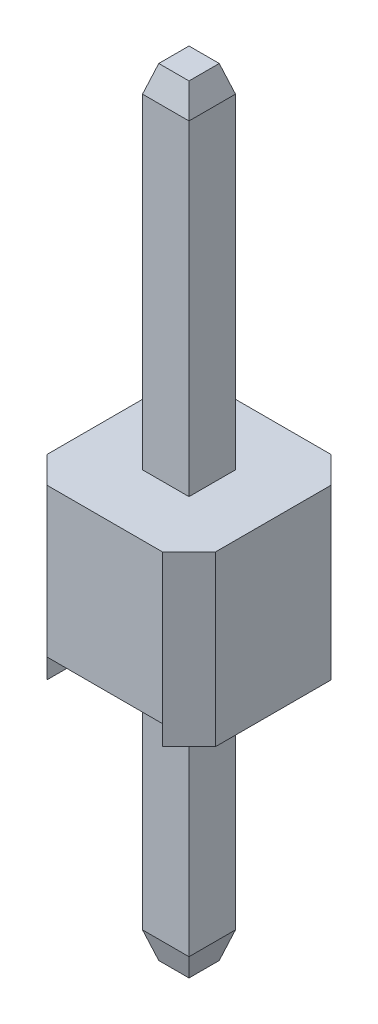
from build123d import *
from OCP.BRepFilletAPI import BRepFilletAPI_MakeChamfer

# Parameters (mm, degrees)
SKETCH1_W           = 2.54
SKETCH1_H           = 2.54
BOSS_EXTRUDE1_DEPTH = 2.54
CHAMFER1_SIZE       = 0.4
SKETCH2_W           = 1.74
SKETCH2_H           = 2.54
CUT_EXTRUDE1_DEPTH  = 0.3
SKETCH3_W           = 0.7
SKETCH3_H           = 0.7
BOSS_EXTRUDE2_DEPTH = 5.3
SKETCH4_W           = 0.7
SKETCH4_H           = 0.7
BOSS_EXTRUDE3_DEPTH = 4.16
CHAMFER2_SIZE       = 0.4
CHAMFER2_SIZE2      = 0.122292273


with BuildPart() as part:
    # Sketch1 → Boss-Extrude1 (new body)
    with BuildSketch(Plane(origin=(0, 0, 0), x_dir=(1, 0, 0), z_dir=(0, 1, 0))):
        Rectangle(SKETCH1_W, SKETCH1_H)
    extrude(amount=BOSS_EXTRUDE1_DEPTH)

    # Chamfer1
    chamfer1_edges = [part.edges().sort_by_distance(p)[0] for p in [
        (1.27, 1.27, 1.27),
        (-1.27, 1.27, 1.27),
        (-1.27, 1.27, -1.27),
        (1.27, 1.27, -1.27),
    ]]
    chamfer(chamfer1_edges, length=CHAMFER1_SIZE)

    # Sketch2 → Cut-Extrude1 (cut)
    with BuildSketch(Plane.XZ):
        Rectangle(SKETCH2_W, SKETCH2_H)
    extrude(amount=-CUT_EXTRUDE1_DEPTH, mode=Mode.SUBTRACT)

    # Sketch3 → Boss-Extrude2 (add)
    with BuildSketch(Plane(origin=(0, 2.54, 0), x_dir=(1, 0, 0), z_dir=(0, 1, 0))):
        Rectangle(SKETCH3_W, SKETCH3_H)
    extrude(amount=BOSS_EXTRUDE2_DEPTH)

    # Sketch4 → Boss-Extrude3 (add)
    with BuildSketch(Plane.XZ.offset(-0.3)):
        Rectangle(SKETCH4_W, SKETCH4_H)
    extrude(amount=BOSS_EXTRUDE3_DEPTH)

    # Chamfer2: one chamfer whose edges measure the first distance from different faces: ONE call of the kernel's chamfer builder (chamfer() names one face for all edges)
    chamfer2_edges_1 = [part.edges().sort_by_distance(p)[0] for p in [
        (-0.35, 7.84, 0),
    ]]
    chamfer2_side_1 = [part.faces().sort_by_distance(p)[0] for p in [
        (-0.35, 5.19, 0),
    ]]
    chamfer2_edges_2 = [part.edges().sort_by_distance(p)[0] for p in [
        (0, 7.84, 0.35),
    ]]
    chamfer2_side_2 = [part.faces().sort_by_distance(p)[0] for p in [
        (0, 5.19, 0.35),
    ]]
    chamfer2_edges_3 = [part.edges().sort_by_distance(p)[0] for p in [
        (0.35, 7.84, 0),
    ]]
    chamfer2_side_3 = [part.faces().sort_by_distance(p)[0] for p in [
        (0.35, 5.19, 0),
    ]]
    chamfer2_edges_4 = [part.edges().sort_by_distance(p)[0] for p in [
        (0, 7.84, -0.35),
    ]]
    chamfer2_side_4 = [part.faces().sort_by_distance(p)[0] for p in [
        (0, 5.19, -0.35),
    ]]
    chamfer2_edges_5 = [part.edges().sort_by_distance(p)[0] for p in [
        (0, -3.86, -0.35),
    ]]
    chamfer2_side_5 = [part.faces().sort_by_distance(p)[0] for p in [
        (0, -1.78, -0.35),
    ]]
    chamfer2_edges_6 = [part.edges().sort_by_distance(p)[0] for p in [
        (0.35, -3.86, 0),
    ]]
    chamfer2_side_6 = [part.faces().sort_by_distance(p)[0] for p in [
        (0.35, -1.78, 0),
    ]]
    chamfer2_edges_7 = [part.edges().sort_by_distance(p)[0] for p in [
        (0, -3.86, 0.35),
    ]]
    chamfer2_side_7 = [part.faces().sort_by_distance(p)[0] for p in [
        (0, -1.78, 0.35),
    ]]
    chamfer2_edges_8 = [part.edges().sort_by_distance(p)[0] for p in [
        (-0.35, -3.86, 0),
    ]]
    chamfer2_side_8 = [part.faces().sort_by_distance(p)[0] for p in [
        (-0.35, -1.78, 0),
    ]]
    chamfer2 = BRepFilletAPI_MakeChamfer(part.part.solid().wrapped)
    for e in chamfer2_edges_1:
        chamfer2.Add(CHAMFER2_SIZE, CHAMFER2_SIZE2, e.wrapped, chamfer2_side_1[0].wrapped)  # the first distance lies on this face
    for e in chamfer2_edges_2:
        chamfer2.Add(CHAMFER2_SIZE, CHAMFER2_SIZE2, e.wrapped, chamfer2_side_2[0].wrapped)  # the first distance lies on this face
    for e in chamfer2_edges_3:
        chamfer2.Add(CHAMFER2_SIZE, CHAMFER2_SIZE2, e.wrapped, chamfer2_side_3[0].wrapped)  # the first distance lies on this face
    for e in chamfer2_edges_4:
        chamfer2.Add(CHAMFER2_SIZE, CHAMFER2_SIZE2, e.wrapped, chamfer2_side_4[0].wrapped)  # the first distance lies on this face
    for e in chamfer2_edges_5:
        chamfer2.Add(CHAMFER2_SIZE, CHAMFER2_SIZE2, e.wrapped, chamfer2_side_5[0].wrapped)  # the first distance lies on this face
    for e in chamfer2_edges_6:
        chamfer2.Add(CHAMFER2_SIZE, CHAMFER2_SIZE2, e.wrapped, chamfer2_side_6[0].wrapped)  # the first distance lies on this face
    for e in chamfer2_edges_7:
        chamfer2.Add(CHAMFER2_SIZE, CHAMFER2_SIZE2, e.wrapped, chamfer2_side_7[0].wrapped)  # the first distance lies on this face
    for e in chamfer2_edges_8:
        chamfer2.Add(CHAMFER2_SIZE, CHAMFER2_SIZE2, e.wrapped, chamfer2_side_8[0].wrapped)  # the first distance lies on this face
    add(Compound.cast(chamfer2.Shape()), mode=Mode.REPLACE)


solid = part.part
